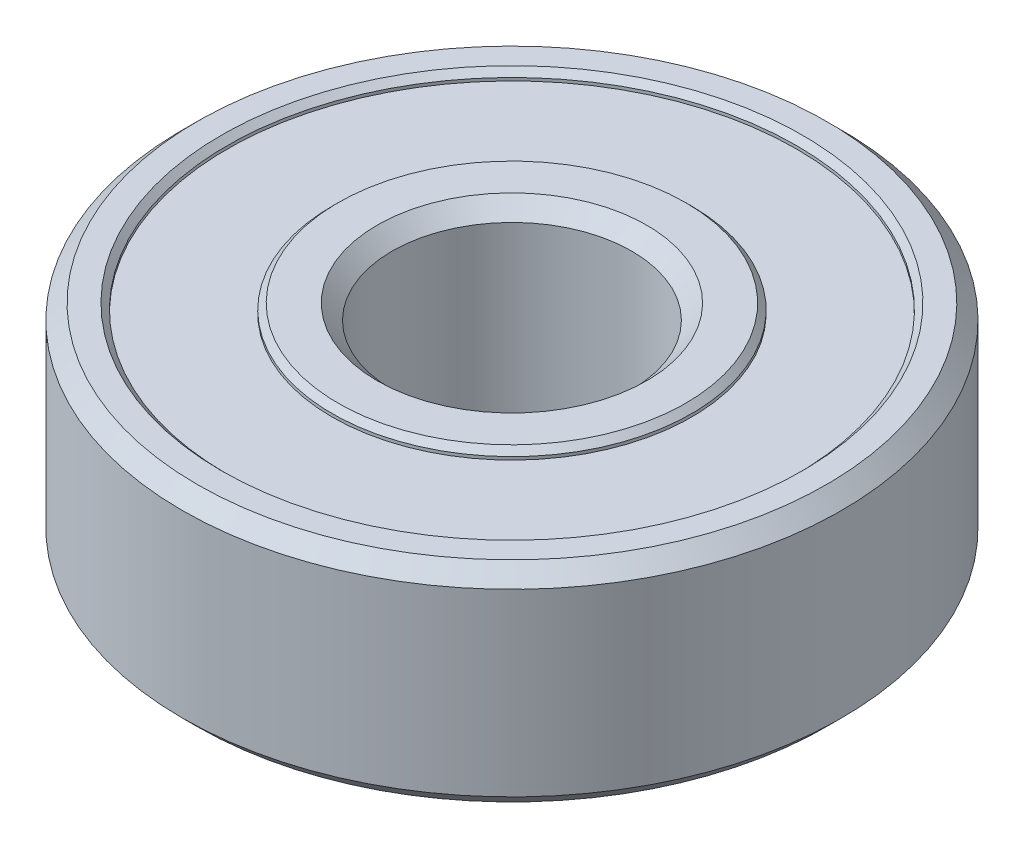
from build123d import *

# Parameters (mm, degrees)
SKETCH1_R             = 11
SKETCH1_R_2           = 9.5
BOSS_EXTRUDE1_DEPTH   = 7
SKETCH1_R_3           = 6
SKETCH1_R_4           = 4
BOSS_EXTRUDE1_2_DEPTH = 7
BOSS_EXTRUDE2_START   = -6.4
SKETCH2_R             = 9.5
SKETCH2_R_2           = 6
BOSS_EXTRUDE2_DEPTH   = 6.4
CHAMFER1_SIZE         = 0.2
CHAMFER2_SIZE         = 0.5


with BuildPart() as part:
    # Sketch1 → Boss-Extrude1 (new body)
    with BuildSketch(Plane(origin=(0, 0, 0), x_dir=(1, 0, 0), z_dir=(0, 1, 0))):
        with Locations(Location((0, 0, 0), (0, 0, 270))):
            Circle(SKETCH1_R)
        with Locations(Location((0, 0, 0), (0, 0, 270))):
            Circle(SKETCH1_R_2, mode=Mode.SUBTRACT)
    extrude(amount=BOSS_EXTRUDE1_DEPTH)



with BuildPart() as body_2:
    # Sketch1 → Boss-Extrude1 2 (new body)
    with BuildSketch(Plane(origin=(0, 0, 0), x_dir=(1, 0, 0), z_dir=(0, 1, 0))):
        with Locations(Location((0, 0, 0), (0, 0, 270))):
            Circle(SKETCH1_R_3)
        with Locations(Location((0, 0, 0), (0, 0, 270))):
            Circle(SKETCH1_R_4, mode=Mode.SUBTRACT)
    extrude(amount=BOSS_EXTRUDE1_2_DEPTH)


with BuildPart() as part_1:
    add(part.part)

    add(body_2.part)  # Boss-Extrude2 merges body 2
    # Sketch2 → Boss-Extrude2 (add)
    with BuildSketch(Plane(origin=(0, 6.7, 0), x_dir=(1, 0, 0), z_dir=(0, 1, 0)).offset(BOSS_EXTRUDE2_START)):
        with Locations(Location((0, 0, 0), (0, 0, 270))):
            Circle(SKETCH2_R)
        with Locations(Location((0, 0, 0), (0, 0, 270))):
            Circle(SKETCH2_R_2, mode=Mode.SUBTRACT)
    extrude(amount=BOSS_EXTRUDE2_DEPTH)

    # Chamfer1
    chamfer1_edges = [part_1.edges().sort_by_distance(p)[0] for p in [
        (0, 0, -6),
        (0, 7, -6),
        (0, 0, -9.5),
        (0, 7, -9.5),
    ]]
    chamfer(chamfer1_edges, length=CHAMFER1_SIZE)

    # Chamfer2
    chamfer2_edges = [part_1.edges().sort_by_distance(p)[0] for p in [
        (0, 7, -11),
        (0, 7, -4),
        (0, 0, -4),
        (0, 0, -11),
    ]]
    chamfer(chamfer2_edges, length=CHAMFER2_SIZE)


solid = part_1.part
